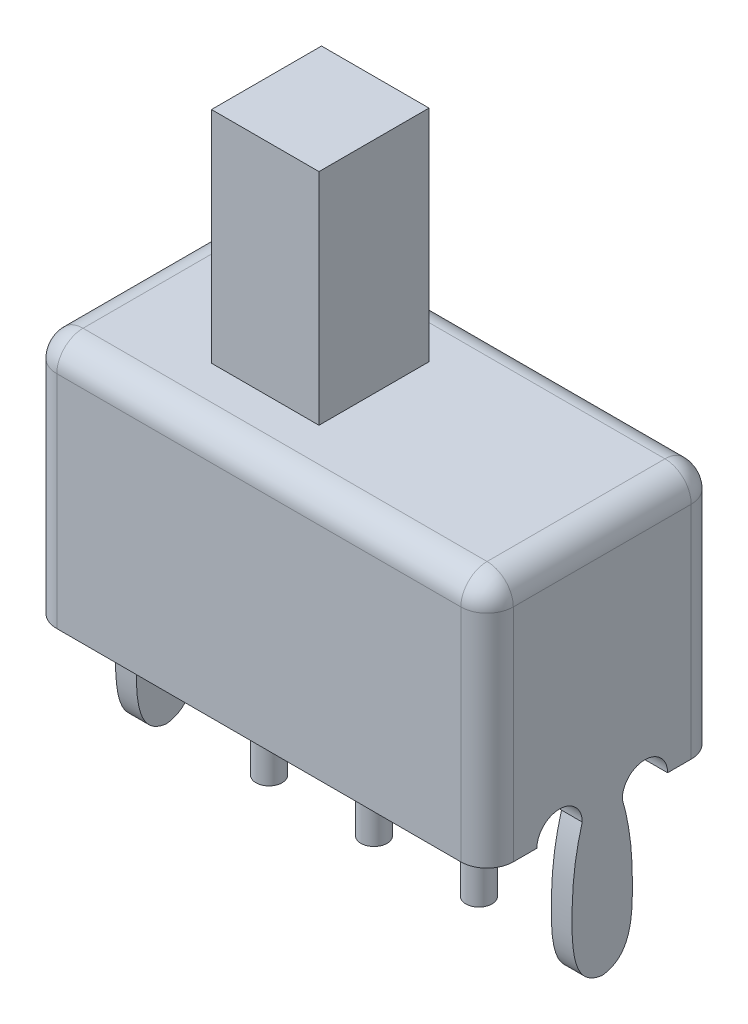
from build123d import *

# Parameters (mm, degrees)
EXTRUDE_1_DEPTH     = 4.35
CUT_EXTRUDE_START   = -2.195068
SKETCH_2_W          = 7.909800434
SKETCH_2_H          = 2.721108573
SKETCH_2_W_2        = 2.301330542
SKETCH_2_H_2        = 4.187137181
SKETCH_2_W_3        = 4.35
CUT_EXTRUDE_1_DEPTH = 13.336862915
FILLET_1_R          = 0.5
EXTRUDE_START       = 4.707534
SKETCH_3_R          = 0.25
EXTRUDE_2_DEPTH     = 7.3


with BuildPart() as part:
    # Эскиз1 → Бобышка-Вытянуть1 (new, symmetric)
    with BuildSketch(Plane(origin=(0, 0, 0), x_dir=(0, 0, -1), z_dir=(1, 0, 0))):
        with BuildLine():
            Line((-2.195067928, 0), (-2.195067928, 4.207534134))
            ThreePointArc((-2.195067928, 4.207534134), (-2.048621319, 4.561087525), (-1.695067928, 4.707534134))
            Line((-1.695067928, 4.707534134), (-1.048425102, 4.707534134))
            Line((-1.048425102, 4.707534134), (-1.048425102, 8.894671315))
            Line((-1.048425102, 8.894671315), (1.048425102, 8.894671315))
            Line((1.048425102, 8.894671315), (1.048425102, 4.707534134))
            Line((1.048425102, 4.707534134), (1.695067928, 4.707534134))
            ThreePointArc((1.695067928, 4.707534134), (2.048621319, 4.561087525), (2.195067928, 4.207534134))
            Line((2.195067928, 4.207534134), (2.195067928, 0))
            Line((2.195067928, 0), (1.245504338, 0))
            ThreePointArc((1.245504338, 0), (0.813528527, 0.431975811), (0.381552716, 0))
            add(Edge.make_bspline(
                [(0.381552716, 0), (0.533291167, -0.533550096), (0.61904307, -1.408984288), (0.53277478, -2.660476036), (0, -2.721108573)],
                knots=[0, 0, 0, 0, 0.537169864, 1, 1, 1, 1], degree=3))
            add(Edge.make_bspline(
                [(-0.381552716, 0), (-0.533291167, -0.533550096), (-0.61904307, -1.408984288), (-0.53277478, -2.660476036), (0, -2.721108573)],
                knots=[0, 0, 0, 0, 0.537169864, 1, 1, 1, 1], degree=3))
            ThreePointArc((-0.381552716, 0), (-0.813528527, 0.431975811), (-1.245504338, 0))
            Line((-1.245504338, 0), (-2.195067928, 0))
        make_face()
    extrude(amount=EXTRUDE_1_DEPTH, both=True)

    # Эскиз2 → Вырез-Вытянуть1 (cut, through all)
    with BuildSketch(Plane.XY.offset(CUT_EXTRUDE_START)):
        with Locations((0, -1.360554286)):
            Rectangle(SKETCH_2_W, SKETCH_2_H)
        with Locations((-3.199334729, 6.801102724)):
            Rectangle(SKETCH_2_W_2, SKETCH_2_H_2)
        with Locations((2.175, 6.801102724)):
            Rectangle(SKETCH_2_W_3, SKETCH_2_H_2)
    extrude(amount=CUT_EXTRUDE_1_DEPTH, mode=Mode.SUBTRACT)

    # Скругление1
    fillet_1_edges = [part.edges().sort_by_distance(p)[0] for p in [
        (-4.35, 2.103767067, 2.195067928),
        (-4.35, 4.561087525, 2.048621319),
        (-4.35, 4.707534134, 0),
        (-4.35, 4.561087525, -2.048621319),
        (-4.35, 2.103767067, -2.195067928),
        (4.35, 2.103767067, -2.195067928),
        (4.35, 4.561087525, -2.048621319),
        (4.35, 4.707534134, 0),
        (4.35, 4.561087525, 2.048621319),
        (4.35, 2.103767067, 2.195067928),
    ]]
    fillet(fillet_1_edges, radius=FILLET_1_R)

    # Эскиз3 → Бобышка-Вытянуть2 (add)
    with BuildSketch(Plane(origin=(0, 0, 0), x_dir=(1, 0, 0), z_dir=(0, 1, 0)).offset(EXTRUDE_START)):
        with Locations(Location((0, 0, 0), (0, 0, 90))):
            Circle(SKETCH_3_R)
        with Locations(Location((-2, 0, 0), (0, 0, 90))):
            Circle(SKETCH_3_R)
        with Locations(Location((2, 0, 0), (0, 0, 90))):
            Circle(SKETCH_3_R)
    extrude(amount=-EXTRUDE_2_DEPTH)


solid = part.part
